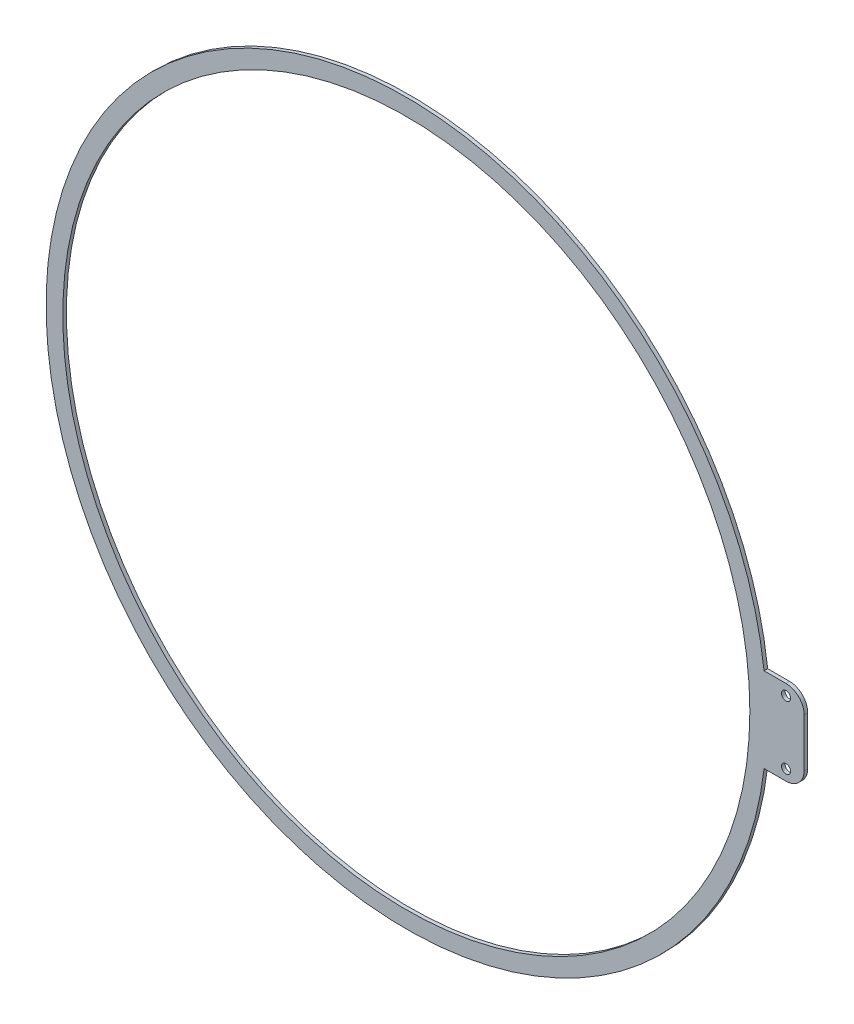
from build123d import *

# Parameters (mm, degrees)
SKETCH1_R           = 1.25
SKETCH1_R_2         = 95
BOSS_EXTRUDE1_DEPTH = 1


with BuildPart() as part:
    # Sketch1 → Boss-Extrude1 (new body)
    with BuildSketch(Plane.XY):
        with BuildLine():
            Line((105, 11.705615426), (98.930670885, 11.705615426))
            ThreePointArc((98.930670885, 11.705615426), (-99.620776318, 0), (98.930670885, -11.705615426))
            Line((98.930670885, -11.705615426), (105, -11.705615426))
            ThreePointArc((105, -11.705615426), (108.535533906, -10.241149332), (110, -6.705615426))
            Line((110, -6.705615426), (110, 6.705615426))
            ThreePointArc((110, 6.705615426), (108.535533906, 10.241149332), (105, 11.705615426))
        make_face()
        with Locations((105, -8.75)):
            Circle(SKETCH1_R, mode=Mode.SUBTRACT)
        with Locations((105, 8.75)):
            Circle(SKETCH1_R, mode=Mode.SUBTRACT)
        Circle(SKETCH1_R_2, mode=Mode.SUBTRACT)
    extrude(amount=BOSS_EXTRUDE1_DEPTH)


solid = part.part
